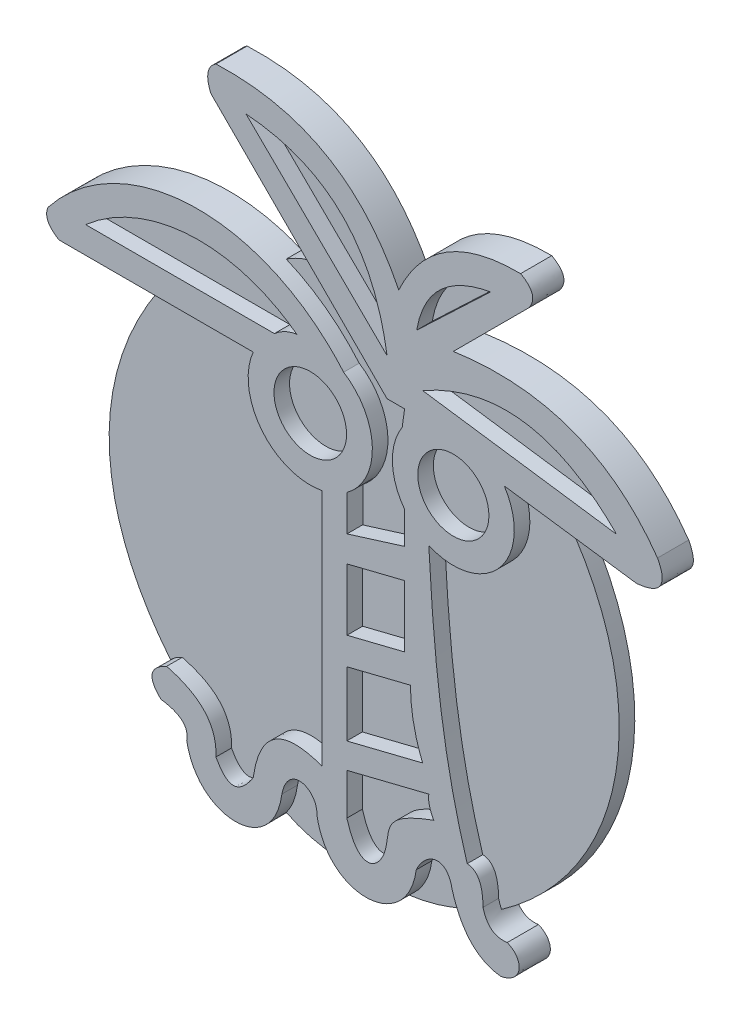
from build123d import *

# Parameters (mm, degrees)
ESBO_O1_R                = 11.645464279
ESBO_O1_R_2              = 11.416238683
RESSALTO_EXTRUS_O1_DEPTH = 10
ESBO_O2_R                = 11.645464279
ESBO_O2_R_2              = 11.416238683
RESSALTO_EXTRUS_O2_DEPTH = 5


with BuildPart() as part:
    # Esboço1 → Ressalto-extrusão1 (new body)
    with BuildSketch(Plane.XY):
        with BuildLine():
            Line((-123.204907446, 28.373586498), (-60.8883604, 28.373586498))
            ThreePointArc((-60.8883604, 28.373586498), (-58.106096312, 7.989055973), (-38.782354105, 0.927677545))
            Line((-38.782354105, 0.927677545), (-38.782354105, -75.663883377))
            add(Edge.make_bspline(
                [(-60.8883604, -89.859231409), (-57.926798803, -68.63551571), (-38.782354105, -75.663883377)],
                knots=[0, 0, 0, 1, 1, 1], degree=2))
            add(Edge.make_bspline(
                [(-72.851597446, -90.127068164), (-69.506753749, -96.370776399), (-65.785346871, -97.538866391), (-60.8883604, -89.859231409)],
                knots=[0, 0, 0, 0, 1, 1, 1, 1], degree=3))
            add(Edge.make_bspline(
                [(-88.65396601, -72.826513449), (-72.255413799, -77.041160255), (-72.851597446, -90.127068164)],
                knots=[0, 0, 0, 1, 1, 1], degree=2))
            add(Edge.make_bspline(
                [(-90.528823297, -82.895475771), (-97.022950563, -76.707597916), (-88.65396601, -72.826513449)],
                knots=[0, 0, 0, 1, 1, 1], degree=2))
            add(Edge.make_bspline(
                [(-82.225883882, -90.127068164), (-81.154662691, -84.234641571), (-90.528823297, -82.895475771)],
                knots=[0, 0, 0, 1, 1, 1], degree=2))
            add(Edge.make_bspline(
                [(-51.692493776, -89.859231409), (-54.370428593, -110.278484389), (-78.877938871, -109.545149232), (-82.225883882, -90.127068164)],
                knots=[0, 0, 0, 0, 1, 1, 1, 1], degree=3))
            add(Edge.make_bspline(
                [(-40.443350053, -90.127068164), (-40.10855489, -83.096369736), (-49.683756858, -79.480757333), (-51.692493776, -89.859231409)],
                knots=[0, 0, 0, 0, 1, 1, 1, 1], degree=3))
            add(Edge.make_bspline(
                [(-8.57077617, -89.323557898), (-11.248695394, -109.407952074), (-36.760795498, -110.883284747), (-40.443350053, -90.127068164)],
                knots=[0, 0, 0, 0, 1, 1, 1, 1], degree=3))
            add(Edge.make_bspline(
                [(2.946204308, -89.055721143), (1.272740989, -80.353711883), (-5.669466059, -82.851404573), (-8.57077617, -89.323557898)],
                knots=[0, 0, 0, 0, 1, 1, 1, 1], degree=3))
            add(Edge.make_bspline(
                [(18.480736117, -105.393763217), (7.297647145, -104.118407885), (2.946204308, -89.055721143)],
                knots=[0, 0, 0, 1, 1, 1], degree=2))
            add(Edge.make_bspline(
                [(20.623430159, -94.94812976), (26.200137577, -97.178812727), (25.84603065, -104.054618757), (18.480736117, -105.393763217)],
                knots=[0, 0, 0, 0, 1, 1, 1, 1], degree=3))
            add(Edge.make_bspline(
                [(12.856164255, -89.055721143), (14.528249261, -95.744061168), (20.623430159, -94.94812976)],
                knots=[0, 0, 0, 1, 1, 1], degree=2))
            add(Edge.make_bspline(
                [(7.767265904, -79.468015141), (12.778347448, -79.734212822), (12.856164255, -89.055721143)],
                knots=[0, 0, 0, 1, 1, 1], degree=2))
            add(Edge.make_bspline(
                [(-4.55322484, 2.812285931), (-2.879343302, -27.987134377), (-0.267814761, -53.085458759), (7.767265904, -79.468015141)],
                knots=[0, 0, 0, 0, 1, 1, 1, 1], degree=3))
            ThreePointArc((-4.55322484, 2.812285931), (18.255686646, 8.087132848), (19.66847483, 31.455369468))
            Line((19.66847483, 31.455369468), (62.138127234, 25.578410133))
            add(Edge.make_bspline(
                [(62.138127234, 25.578410133), (73.853994026, 26.653474159), (68.834046117, 36.02404359)],
                knots=[0, 0, 0, 1, 1, 1], degree=2))
            add(Edge.make_bspline(
                [(68.834046117, 36.02404359), (47.045470919, 67.02611544), (3.320500621, 60.665025079)],
                knots=[0, 0, 0, 1, 1, 1], degree=2))
            Line((3.320500621, 60.665025079), (27.640415576, 84.984940034))
            add(Edge.make_bspline(
                [(27.640415576, 84.984940034), (30.929457341, 89.728472975), (24.908818244, 93.073272473)],
                knots=[0, 0, 0, 1, 1, 1], degree=2))
            add(Edge.make_bspline(
                [(24.908818244, 93.073272473), (-2.877228496, 93.40804412), (-14.195348032, 68.967964494)],
                knots=[0, 0, 0, 1, 1, 1], degree=2))
            add(Edge.make_bspline(
                [(-14.195348032, 68.967964494), (-31.602669645, 104.117363906), (-72.851597446, 102.447558909)],
                knots=[0, 0, 0, 1, 1, 1], degree=2))
            add(Edge.make_bspline(
                [(-72.851597446, 102.447558909), (-77.136443631, 99.685728752), (-74.458617978, 93.402036475)],
                knots=[0, 0, 0, 1, 1, 1], degree=2))
            Line((-74.458617978, 93.402036475), (-17.945062606, 36.888481103))
            Line((-17.945062606, 36.888481103), (-12.320490745, 36.888481103))
            Line((-12.320490745, 36.888481103), (-13.084384997, 31.368224537))
            ThreePointArc((-13.084384997, 31.368224537), (-16.227551117, 20.050139903), (-12.320490745, 8.972531303))
            Line((-12.320490745, 8.972531303), (-12.320490745, -1.339183777))
            Line((-12.320490745, -1.339183777), (-30.801226861, -7.097674016))
            Line((-30.801226861, -7.097674016), (-30.801226861, 4.419306463))
            ThreePointArc((-30.801226861, 4.419306463), (-22.668330317, 21.136113738), (-31.868337507, 37.29023146))
            add(Edge.make_bspline(
                [(-126.686785265, 35.756206835), (-103.12361651, 65.485438442), (-58.459543118, 68.098228977), (-31.868337507, 37.29023146)],
                knots=[0, 0, 0, 0, 0.986678025, 0.986678025, 0.986678025, 0.986678025], degree=3))
            add(Edge.make_bspline(
                [(-123.204907446, 28.373586498), (-128.556271702, 31.572324539), (-126.686785265, 35.756206835)],
                knots=[0, 0, 0, 1, 1, 1], degree=2))
        make_face()
        with BuildLine():
            Line((-30.848072789, -86.109516834), (-30.848072789, -72.826513449))
            Line((-30.848072789, -72.826513449), (-4.55322484, -66.289596941))
            add(Edge.make_bspline(
                [(-4.55322484, -66.289596941), (-4.93429951, -69.39529452), (-2.946204308, -72.7551796)],
                knots=[0, 0, 0, 1, 1, 1], degree=2))
            add(Edge.make_bspline(
                [(-30.848072789, -86.109516834), (-27.107752687, -99.497801306), (-18.873497626, -94.871242364), (-17.474210061, -81.105104545), (-15.668014198, -77.395288133), (-2.946204308, -72.7551796)],
                knots=[0, 0, 0, 0, 0.568308547, 0.668308547, 1, 1, 1, 1], degree=3))
        make_face(mode=Mode.SUBTRACT)
        with BuildLine():
            Line((-30.876345381, -64.682576409), (-30.81494597, -44.034072396))
            Line((-30.81494597, -44.034072396), (-10.445633457, -38.970247899))
            add(Edge.make_bspline(
                [(-10.445633457, -38.970247899), (-10.415083826, -49.124507463), (-6.543395685, -58.633389098)],
                knots=[0, 0, 0, 1, 1, 1], degree=2))
            Line((-6.543395685, -58.633389098), (-30.876345381, -64.682576409))
        make_face(mode=Mode.SUBTRACT)
        Polygon((-30.801226861, -35.261631647), (-30.801226861, -15.441711753), (-12.320490745, -10.84738859), (-12.320490745, -30.667308484), align=None, mode=Mode.SUBTRACT)
        with BuildLine():
            Line((-54.103024574, 36.912152344), (-114.667716936, 36.912152344))
            add(Edge.make_bspline(
                [(-114.667716936, 36.912152344), (-95.473170337, 53.712411106), (-67.628708559, 55.709991569), (-46.87143218, 40.309431675)],
                knots=[0, 0, 0, 0, 1, 1, 1, 1], degree=3))
            add(Edge.make_bspline(
                [(-54.103024574, 36.912152344), (-50.761070672, 39.814352436), (-46.87143218, 40.309431675)],
                knots=[0, 0, 0, 1, 1, 1], degree=2))
        make_face(mode=Mode.SUBTRACT)
        with Locations((-42.586044095, 20.489511782)):
            Circle(ESBO_O1_R, mode=Mode.SUBTRACT)
        with BuildLine():
            Line((-17.945062606, 48.880207845), (-63.209474255, 93.402036475))
            add(Edge.make_bspline(
                [(-63.209474255, 93.402036475), (-24.305987606, 90.393613104), (-17.945062606, 48.880207845)],
                knots=[0, 0, 0, 1, 1, 1], degree=2))
        make_face(mode=Mode.SUBTRACT)
        with Locations((3.320500621, 20.716904008)):
            Circle(ESBO_O1_R_2, mode=Mode.SUBTRACT)
        with BuildLine():
            Line((55.710045106, 36.02404359), (-6.543395685, 44.862656516))
            add(Edge.make_bspline(
                [(-6.543395685, 44.862656516), (27.749636521, 64.280653645), (55.710045106, 36.02404359)],
                knots=[0, 0, 0, 1, 1, 1], degree=2))
        make_face(mode=Mode.SUBTRACT)
        with BuildLine():
            Line((15.266695053, 83.163312526), (-8.44563346, 60.665025079))
            add(Edge.make_bspline(
                [(-8.44563346, 60.665025079), (-5.155776431, 79.480571766), (15.266695053, 83.163312526)],
                knots=[0, 0, 0, 1, 1, 1], degree=2))
        make_face(mode=Mode.SUBTRACT)
    extrude(amount=RESSALTO_EXTRUS_O1_DEPTH)

    # Esboço2 → Ressalto-extrusão2 (add)
    with BuildSketch(Plane.XY):
        with BuildLine():
            Line((-60.8883604, 28.373586498), (-94.010701116, 28.373586498))
            add(Edge.make_bspline(
                [(-92.386237118, -75.420348667), (-118.736939938, -43.037858448), (-118.105611708, -4.902863601), (-94.010701116, 28.373586498)],
                knots=[0, 0, 0, 0, 1, 1, 1, 1], degree=3))
            add(Edge.make_bspline(
                [(-92.386237118, -75.420348667), (-91.217258492, -74.0152305), (-88.65396601, -72.826513449)],
                knots=[0, 0, 0, 1, 1, 1], degree=2))
            add(Edge.make_bspline(
                [(-88.65396601, -72.826513449), (-72.255413799, -77.041160255), (-72.851597446, -90.127068164)],
                knots=[0, 0, 0, 1, 1, 1], degree=2))
            add(Edge.make_bspline(
                [(-72.851597446, -90.127068164), (-69.50675375, -96.370776399), (-65.785346872, -97.538866391), (-60.8883604, -89.859231409)],
                knots=[0, 0, 0, 0, 1, 1, 1, 1], degree=3))
            add(Edge.make_bspline(
                [(-60.8883604, -89.859231409), (-57.926798803, -68.63551571), (-38.782354105, -75.663883377)],
                knots=[0, 0, 0, 1, 1, 1], degree=2))
            Line((-38.782354105, -75.663883377), (-38.782354105, 0.560365276))
            ThreePointArc((-38.782354105, 0.560365276), (-58.365724007, 7.687022581), (-60.8883604, 28.373586498))
        make_face()
        with BuildLine():
            ThreePointArc((-4.55322484, 2.812285931), (18.255686646, 8.087132848), (19.66847483, 31.455369468))
            Line((19.66847483, 31.455369468), (33.246126664, 29.576491182))
            add(Edge.make_bspline(
                [(33.246126664, 29.576491182), (63.669162165, -9.904528952), (55.46987978, -62.292868277), (13.814441536, -91.652478342)],
                knots=[0, 0, 0, 0, 1, 1, 1, 1], degree=3))
            add(Edge.make_bspline(
                [(12.856164255, -89.055721143), (13.226700241, -90.537865088), (13.814441536, -91.652478342)],
                knots=[0, 0, 0, 1, 1, 1], degree=2))
            add(Edge.make_bspline(
                [(7.767265904, -79.468015142), (12.778347448, -79.734212822), (12.856164255, -89.055721143)],
                knots=[0, 0, 0, 1, 1, 1], degree=2))
            add(Edge.make_bspline(
                [(-4.55322484, 2.812285931), (-2.879343302, -27.987134377), (-0.267814761, -53.085458759), (7.767265904, -79.468015142)],
                knots=[0, 0, 0, 0, 1, 1, 1, 1], degree=3))
        make_face()
        with BuildLine():
            add(Edge.make_bspline(
                [(-55.282924758, -99.217324476), (-45.441625129, -104.257725972), (-30.848072789, -103.741760974)],
                knots=[0, 0, 0, 1, 1, 1], degree=2))
            add(Edge.make_bspline(
                [(-30.848072789, -103.741760974), (-35.402391414, -101.687148671), (-39.189073181, -97.196628715), (-40.443350053, -90.127068164)],
                knots=[0.659400328, 0.659400328, 0.659400328, 0.659400328, 1, 1, 1, 1], degree=3))
            add(Edge.make_bspline(
                [(-40.443350053, -90.127068164), (-40.10855489, -83.096369736), (-49.683756858, -79.480757333), (-51.692493776, -89.859231409)],
                knots=[0, 0, 0, 0, 1, 1, 1, 1], degree=3))
            add(Edge.make_bspline(
                [(-51.692493776, -89.859231409), (-52.20080171, -93.735079407), (-53.495610254, -96.848818059), (-55.282924758, -99.217324476)],
                knots=[0, 0, 0, 0, 0.189813408, 0.189813408, 0.189813408, 0.189813408], degree=3))
        make_face()
        with BuildLine():
            add(Edge.make_bspline(
                [(2.946204308, -89.055721143), (1.272740989, -80.353711883), (-5.669466059, -82.851404573), (-8.57077617, -89.323557898)],
                knots=[0, 0, 0, 0, 1, 1, 1, 1], degree=3))
            add(Edge.make_bspline(
                [(-8.57077617, -89.323557898), (-9.408151281, -95.603871231), (-12.478227501, -100.064610984), (-16.41540743, -102.595019272)],
                knots=[0, 0, 0, 0, 0.31269618, 0.31269618, 0.31269618, 0.31269618], degree=3))
            add(Edge.make_bspline(
                [(-16.41540743, -102.595019272), (-4.605462892, -101.072105825), (5.407210165, -95.450003878)],
                knots=[0, 0, 0, 1, 1, 1], degree=2))
            add(Edge.make_bspline(
                [(5.407210165, -95.450003878), (3.982847571, -92.644101666), (2.946204308, -89.055721143)],
                knots=[0, 0, 0, 1, 1, 1], degree=2))
        make_face()
        with BuildLine():
            Line((-30.848072789, -72.826513449), (-30.848072789, -86.109516834))
            add(Edge.make_bspline(
                [(-30.848072789, -86.109516834), (-27.107752687, -99.497801306), (-18.873497626, -94.871242364), (-17.474210061, -81.105104545), (-15.668014198, -77.395288133), (-2.946204309, -72.7551796)],
                knots=[0, 0, 0, 0, 0.568308547, 0.668308547, 1, 1, 1, 1], degree=3))
            add(Edge.make_bspline(
                [(-4.55322484, -66.289596941), (-4.93429951, -69.39529452), (-2.946204309, -72.7551796)],
                knots=[0, 0, 0, 1, 1, 1], degree=2))
            Line((-4.55322484, -66.289596941), (-30.848072789, -72.826513449))
        make_face()
        with BuildLine():
            add(Edge.make_bspline(
                [(-10.445633457, -38.970247899), (-10.415083826, -49.124507463), (-6.543395685, -58.633389098)],
                knots=[0, 0, 0, 1, 1, 1], degree=2))
            Line((-6.543395685, -58.633389098), (-30.876345381, -64.682576409))
            Line((-30.876345381, -64.682576409), (-30.81494597, -44.034072396))
            Line((-30.81494597, -44.034072396), (-10.445633457, -38.970247899))
        make_face()
        Polygon((-30.801226861, -15.441711753), (-12.320490745, -10.84738859), (-12.320490745, -30.667308484), (-30.801226861, -35.261631647), align=None)
        with BuildLine():
            add(Edge.make_bspline(
                [(-39.609376163, 58.55279466), (-47.677781595, 59.518531216), (-55.282924758, 54.526565568)],
                knots=[0, 0, 0, 1, 1, 1], degree=2))
            add(Edge.make_bspline(
                [(-55.282924758, 54.526565568), (-46.278298371, 50.72696124), (-37.85937382, 44.601032299), (-30.801226861, 36.02404359)],
                knots=[0.733134945, 0.733134945, 0.733134945, 0.733134945, 1, 1, 1, 1], degree=3))
            ThreePointArc((-30.801226861, 36.02404359), (-22.83689294, 20.168564378), (-30.670476907, 4.248080777))
            Line((-30.670476907, 4.248080777), (-30.670476907, -7.268899702))
            Line((-30.670476907, -7.268899702), (-12.189740791, -1.510409463))
            Line((-12.189740791, -1.510409463), (-12.189740791, 8.801305617))
            ThreePointArc((-12.189740791, 8.801305617), (-16.223244648, 19.942594285), (-13.084384997, 31.368224537))
            Line((-13.084384997, 31.368224537), (-12.320490745, 36.888481103))
            Line((-12.320490745, 36.888481103), (-17.945062606, 36.888481103))
            Line((-17.945062606, 36.888481103), (-39.609376163, 58.55279466))
        make_face()
        with Locations((-42.586044095, 20.489511782)):
            Circle(ESBO_O2_R)
        with BuildLine():
            add(Edge.make_bspline(
                [(-114.667716936, 36.912152344), (-95.473170337, 53.712411106), (-67.628708559, 55.709991569), (-46.87143218, 40.309431675)],
                knots=[0, 0, 0, 0, 1, 1, 1, 1], degree=3))
            add(Edge.make_bspline(
                [(-54.103024574, 36.912152344), (-50.761070672, 39.814352436), (-46.87143218, 40.309431675)],
                knots=[0, 0, 0, 1, 1, 1], degree=2))
            Line((-54.103024574, 36.912152344), (-114.667716936, 36.912152344))
        make_face()
        with BuildLine():
            add(Edge.make_bspline(
                [(-63.209474255, 93.402036475), (-24.305987606, 90.393613104), (-17.945062606, 48.880207845)],
                knots=[0, 0, 0, 1, 1, 1], degree=2))
            Line((-17.945062606, 48.880207845), (-63.209474255, 93.402036475))
        make_face()
        with BuildLine():
            add(Edge.make_bspline(
                [(-8.44563346, 60.665025079), (-5.155776431, 79.480571766), (15.266695053, 83.163312526)],
                knots=[0, 0, 0, 1, 1, 1], degree=2))
            Line((15.266695053, 83.163312526), (-8.44563346, 60.665025079))
        make_face()
        with BuildLine():
            add(Edge.make_bspline(
                [(-6.543395685, 44.862656516), (27.749636521, 64.280653645), (55.710045106, 36.02404359)],
                knots=[0, 0, 0, 1, 1, 1], degree=2))
            Line((55.710045106, 36.02404359), (-6.543395685, 44.862656516))
        make_face()
        with Locations((3.320500621, 20.716904008)):
            Circle(ESBO_O2_R_2)
    extrude(amount=RESSALTO_EXTRUS_O2_DEPTH)


solid = part.part
